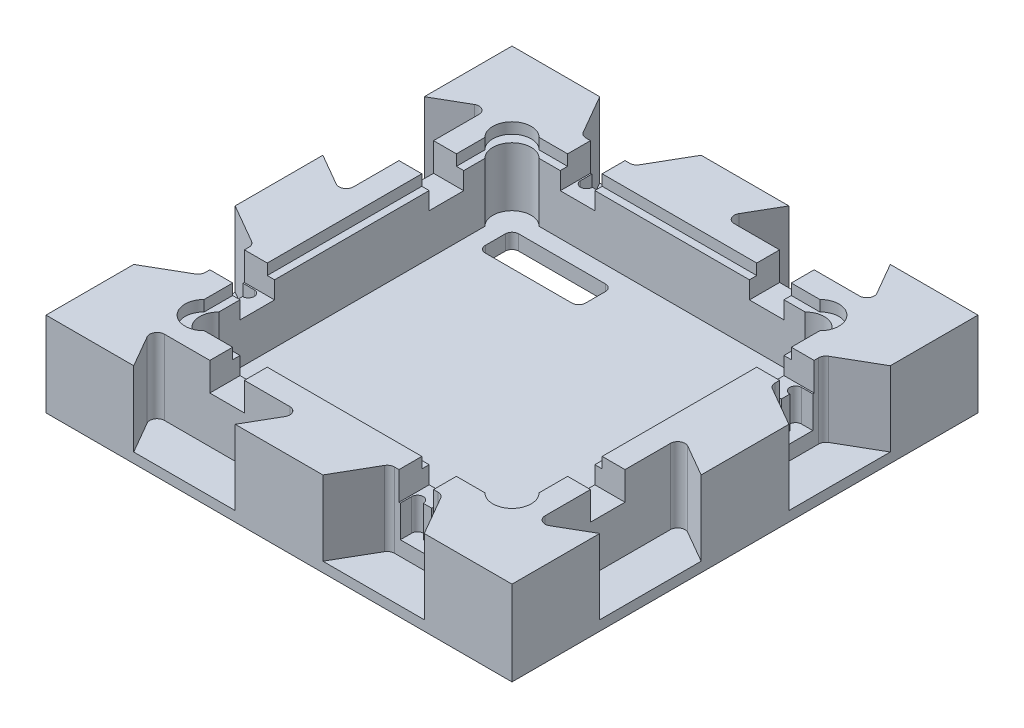
from build123d import *

# Parameters (mm, degrees)
SKETCH1_W                          = 139.7
SKETCH1_H                          = 139.7
BOSS_EXTRUDE1_DEPTH                = 12.7
POWER_SUPPLY_COMPONENT_DEPTH_DEPTH = 20.9
CUT_EXTRUDE6_DEPTH                 = 22.4
SKETCH8_W                          = 10.36
SKETCH8_H                          = 9.05
CUT_EXTRUDE7_DEPTH                 = 8.48
CUT_EXTRUDE8_DEPTH                 = 9.53
FILLET2_R                          = 2.2
CIRPATTERN5_COUNT                  = 4
FILLET2_OF_CIRPATTERN5_R           = 2.2
CUT_EXTRUDE9_DEPTH                 = 3.25
SKETCH12_W                         = 30
SKETCH12_H                         = 10
CUT_EXTRUDE10_DEPTH                = 101.969574625
FILLET5_R                          = 2
CIRPATTERN6_COUNT                  = 2
FILLET5_OF_CIRPATTERN6_R           = 2


with BuildPart() as part:
    # Sketch1 → Boss-Extrude1 (new, symmetric)
    with BuildSketch(Plane(origin=(0, 0, 0), x_dir=(1, 0, 0), z_dir=(0, 1, 0))):
        Rectangle(SKETCH1_W, SKETCH1_H)
    extrude(amount=BOSS_EXTRUDE1_DEPTH, both=True)

    # Sketch6 → power_supply_component_depth (cut)
    with BuildSketch(Plane(origin=(0, 12.7, 0), x_dir=(1, 0, 0), z_dir=(0, 1, 0))):
        with BuildLine():
            Line((-48, 39.868272016), (-48, -39.868272016))
            ThreePointArc((-48, -39.868272016), (-48, -48), (-39.868272016, -48))
            Line((-39.868272016, -48), (39.868272016, -48))
            ThreePointArc((39.868272016, -48), (48, -48), (48, -39.868272016))
            Line((48, -39.868272016), (48, 39.868272016))
            ThreePointArc((48, 39.868272016), (48, 48), (39.868272016, 48))
            Line((39.868272016, 48), (-39.868272016, 48))
            ThreePointArc((-39.868272016, 48), (-48, 48), (-48, 39.868272016))
        make_face()
    extrude(amount=-POWER_SUPPLY_COMPONENT_DEPTH_DEPTH, mode=Mode.SUBTRACT)

    # Sketch4 → Cut-Extrude6 (cut)
    with BuildSketch(Plane(origin=(0, 12.7, 0), x_dir=(1, 0, 0), z_dir=(0, 1, 0))):
        Polygon((-43.55, -69.85), (-50.940083446, -57.05), (-5.759916554, -57.05), (-13.15, -69.85), align=None)
        Polygon((43.55, -69.85), (36.159916554, -57.05), (20.540083446, -57.05), (13.15, -69.85), align=None)
    cut_extrude6 = extrude(amount=-CUT_EXTRUDE6_DEPTH, mode=Mode.SUBTRACT)

    # Sketch8 → Cut-Extrude7 (cut)
    with BuildSketch(Plane(origin=(0, 12.7, 0), x_dir=(1, 0, 0), z_dir=(0, 1, 0))):
        with Locations((-28.35, -52.525)):
            Rectangle(SKETCH8_W, SKETCH8_H)
        with Locations((28.35, -52.525)):
            Rectangle(SKETCH8_W, SKETCH8_H)
    cut_extrude7 = extrude(amount=-CUT_EXTRUDE7_DEPTH, mode=Mode.SUBTRACT)

    # Sketch9 → Cut-Extrude8 (cut)
    with BuildSketch(Plane(origin=(0, 4.22, 0), x_dir=(1, 0, 0), z_dir=(0, 1, 0))):
        with BuildLine():
            Line((27.085, -53.675), (29.615, -53.675))
            ThreePointArc((29.615, -53.675), (31.365, -51.925), (33.115, -53.675))
            Line((33.115, -53.675), (33.115, -57.05))
            Line((33.115, -57.05), (23.585, -57.05))
            Line((23.585, -57.05), (23.585, -53.675))
            ThreePointArc((23.585, -53.675), (25.335, -51.925), (27.085, -53.675))
        make_face()
    cut_extrude8 = extrude(amount=-CUT_EXTRUDE8_DEPTH, mode=Mode.SUBTRACT)

    # Fillet2
    fillet2_edges = [part.edges().sort_by_distance(p)[0] for p in [
        (-5.759916554, 1.5, 57.05),
        (-50.940083446, 1.5, 57.05),
        (36.159916554, 1.5, 57.05),
        (20.540083446, 1.5, 57.05),
    ]]
    fillet(fillet2_edges, radius=FILLET2_R)

    # CirPattern5: Cut-Extrude6, Cut-Extrude7, Cut-Extrude8 ×4 about axis
    cirpattern5_axis = Axis((0, 0, 0), (0, 1, 0))
    add([cut_extrude6.rotate(cirpattern5_axis, i * 360 / CIRPATTERN5_COUNT) for i in range(1, CIRPATTERN5_COUNT)], mode=Mode.SUBTRACT)
    add([cut_extrude7.rotate(cirpattern5_axis, i * 360 / CIRPATTERN5_COUNT) for i in range(1, CIRPATTERN5_COUNT)], mode=Mode.SUBTRACT)
    add([cut_extrude8.rotate(cirpattern5_axis, i * 360 / CIRPATTERN5_COUNT) for i in range(1, CIRPATTERN5_COUNT)], mode=Mode.SUBTRACT)

    # Fillet2 of CirPattern5
    fillet2_of_cirpattern5_edges = [part.edges().sort_by_distance(p)[0] for p in [
        (57.05, 1.5, 5.759916554),
        (57.05, 1.5, 50.940083446),
        (57.05, 1.5, -36.159916554),
        (57.05, 1.5, -20.540083446),
        (5.759916554, 1.5, -57.05),
        (50.940083446, 1.5, -57.05),
        (-36.159916554, 1.5, -57.05),
        (-20.540083446, 1.5, -57.05),
        (-57.05, 1.5, -5.759916554),
        (-57.05, 1.5, -50.940083446),
        (-57.05, 1.5, 36.159916554),
        (-57.05, 1.5, 20.540083446),
    ]]
    fillet(fillet2_of_cirpattern5_edges, radius=FILLET2_OF_CIRPATTERN5_R)

    # Sketch10 → Cut-Extrude9 (cut)
    with BuildSketch(Plane(origin=(0, 12.7, 0), x_dir=(1, 0, 0), z_dir=(0, 1, 0))):
        with BuildLine():
            Line((-42.068272016, 50.2), (42.068272016, 50.2))
            ThreePointArc((42.068272016, 50.2), (50.2, 50.2), (50.2, 42.068272016))
            Line((50.2, 42.068272016), (50.2, -42.068272016))
            ThreePointArc((50.2, -42.068272016), (50.2, -50.2), (42.068272016, -50.2))
            Line((42.068272016, -50.2), (-42.068272016, -50.2))
            ThreePointArc((-42.068272016, -50.2), (-50.2, -50.2), (-50.2, -42.068272016))
            Line((-50.2, -42.068272016), (-50.2, 42.068272016))
            ThreePointArc((-50.2, 42.068272016), (-50.2, 50.2), (-42.068272016, 50.2))
        make_face()
    extrude(amount=-CUT_EXTRUDE9_DEPTH, mode=Mode.SUBTRACT)

    # Sketch12 → Cut-Extrude10 (cut, symmetric)
    with BuildSketch(Plane(origin=(0, -8.2, 0), x_dir=(1, 0, 0), z_dir=(0, 1, 0))):
        with Locations((-28, 38)):
            Rectangle(SKETCH12_W, SKETCH12_H)
    cut_extrude10 = extrude(amount=CUT_EXTRUDE10_DEPTH, both=True, mode=Mode.SUBTRACT)

    # Fillet5
    fillet5_edges = [part.edges().sort_by_distance(p)[0] for p in [
        (-43, -10.45, -33),
        (-43, -10.45, -43),
        (-13, -10.45, -43),
        (-13, -10.45, -33),
    ]]
    fillet(fillet5_edges, radius=FILLET5_R)

    # CirPattern6: Cut-Extrude10 ×2 about axis
    cirpattern6_axis = Axis((0, 0, 0), (0, 1, 0))
    for i in range(1, CIRPATTERN6_COUNT):
        add(cut_extrude10.rotate(cirpattern6_axis, i * 360 / CIRPATTERN6_COUNT), mode=Mode.SUBTRACT)

    # Fillet5 of CirPattern6
    fillet5_of_cirpattern6_edges = [part.edges().sort_by_distance(p)[0] for p in [
        (43, -10.45, 33),
        (43, -10.45, 43),
        (13, -10.45, 43),
        (13, -10.45, 33),
    ]]
    fillet(fillet5_of_cirpattern6_edges, radius=FILLET5_OF_CIRPATTERN6_R)


solid = part.part
